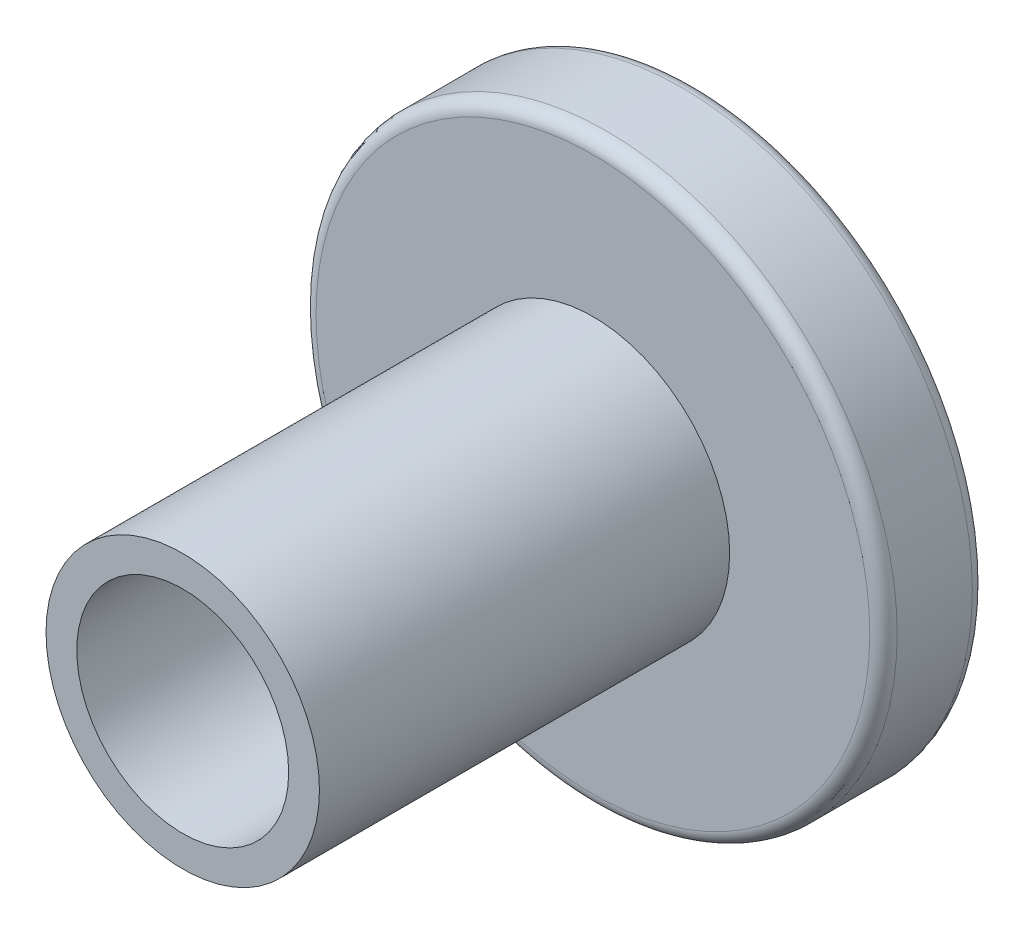
from build123d import *

# Parameters (mm, degrees)
SKETCH_1_R          = 4.25
EXTRUDE_1_DEPTH     = 1.5
SKETCH_2_R          = 2
SKETCH_2_R_2        = 1.55
EXTRUDE_2_DEPTH     = 6
FILLET_1_R          = 0.2
CUT_EXTRUDE_1_DEPTH = 1.5


with BuildPart() as part:
    # 草图1 → 凸台-拉伸1 (new body)
    with BuildSketch(Plane.XY):
        Circle(SKETCH_1_R)
    extrude(amount=EXTRUDE_1_DEPTH)

    # 草图2 → 凸台-拉伸2 (add)
    with BuildSketch(Plane.XY.offset(1.5)):
        Circle(SKETCH_2_R)
        Circle(SKETCH_2_R_2, mode=Mode.SUBTRACT)
    extrude(amount=EXTRUDE_2_DEPTH)

    # 圆角1
    fillet_1_edges = [part.edges().sort_by_distance(p)[0] for p in [
        (-4.25, 0, 0),
        (-4.25, 0, 1.5),
    ]]
    fillet(fillet_1_edges, radius=FILLET_1_R)

    # 草图3 → 切除-拉伸1 (cut)
    with BuildSketch(Plane(origin=(0, 0, 0), x_dir=(-1, 0, 0), z_dir=(0, 0, -1))):
        Polygon((1.443375673, 0), (0.721687836, 1.25), (-0.721687836, 1.25), (-1.443375673, 0), (-0.721687836, -1.25), (0.721687836, -1.25), align=None)
    extrude(amount=-CUT_EXTRUDE_1_DEPTH, mode=Mode.SUBTRACT)


solid = part.part
